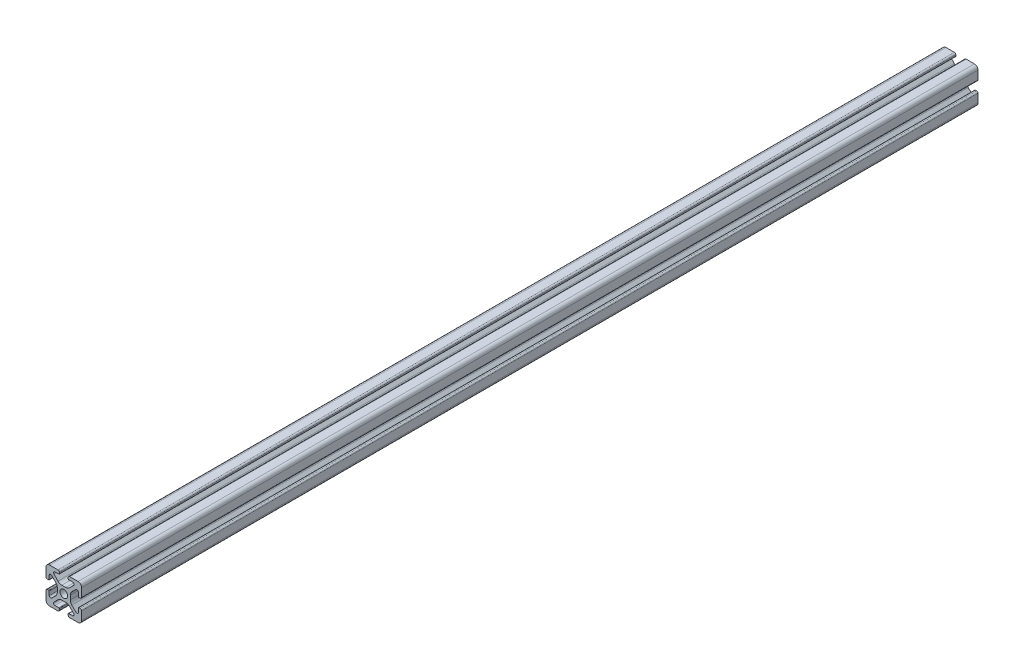
from build123d import *

# Parameters (mm, degrees)
ESQUISSE1_R        = 2.15
BOSS_EXTRU_1_DEPTH = 504


with BuildPart() as part:
    # Esquisse1 → Boss.-Extru.1 (new body)
    with BuildSketch(Plane(origin=(0, 0, 0), x_dir=(-1, 0, 0), z_dir=(0, 0, -1))):
        with BuildLine():
            Line((-20, 6.7), (-20, 2))
            ThreePointArc((-20, 2), (-19.414213562, 0.585786438), (-18, 0))
            Line((-18, 0), (-13.3, 0))
            ThreePointArc((-13.3, 0), (-12.734314575, 0.234314575), (-12.5, 0.8))
            Line((-12.5, 0.8), (-12.5, 1.5))
            ThreePointArc((-12.5, 1.5), (-12.587867966, 1.712132034), (-12.8, 1.8))
            Line((-12.8, 1.8), (-14.918424061, 1.8))
            ThreePointArc((-14.918424061, 1.8), (-15.686700051, 2.313345604), (-15.506437047, 3.219588924))
            Line((-15.506437047, 3.219588924), (-13.254705627, 5.471320344))
            ThreePointArc((-13.254705627, 5.471320344), (-12.281435581, 6.121638598), (-11.133385284, 6.35))
            Line((-11.133385284, 6.35), (-8.866614716, 6.35))
            ThreePointArc((-8.866614716, 6.35), (-7.718564419, 6.121638598), (-6.745294373, 5.471320344))
            Line((-6.745294373, 5.471320344), (-4.493562953, 3.219588924))
            ThreePointArc((-4.493562953, 3.219588924), (-4.313299949, 2.313345604), (-5.081575939, 1.8))
            Line((-5.081575939, 1.8), (-7.2, 1.8))
            ThreePointArc((-7.2, 1.8), (-7.412132034, 1.712132034), (-7.5, 1.5))
            Line((-7.5, 1.5), (-7.5, 0.8))
            ThreePointArc((-7.5, 0.8), (-7.265685425, 0.234314575), (-6.7, 0))
            Line((-6.7, 0), (-2, 0))
            ThreePointArc((-2, 0), (-0.585786438, 0.585786438), (0, 2))
            Line((0, 2), (0, 6.7))
            ThreePointArc((0, 6.7), (-0.234314575, 7.265685425), (-0.8, 7.5))
            Line((-0.8, 7.5), (-1.5, 7.5))
            ThreePointArc((-1.5, 7.5), (-1.712132034, 7.412132034), (-1.8, 7.2))
            Line((-1.8, 7.2), (-1.8, 5.081575939))
            ThreePointArc((-1.8, 5.081575939), (-2.313345604, 4.313299949), (-3.219588924, 4.493562953))
            Line((-3.219588924, 4.493562953), (-5.471320344, 6.745294373))
            ThreePointArc((-5.471320344, 6.745294373), (-6.121638598, 7.718564419), (-6.35, 8.866614716))
            Line((-6.35, 8.866614716), (-6.35, 11.133385284))
            ThreePointArc((-6.35, 11.133385284), (-6.121638598, 12.281435581), (-5.471320344, 13.254705627))
            Line((-5.471320344, 13.254705627), (-3.219588924, 15.506437047))
            ThreePointArc((-3.219588924, 15.506437047), (-2.313345604, 15.686700051), (-1.8, 14.918424061))
            Line((-1.8, 14.918424061), (-1.8, 12.8))
            ThreePointArc((-1.8, 12.8), (-1.712132034, 12.587867966), (-1.5, 12.5))
            Line((-1.5, 12.5), (-0.8, 12.5))
            ThreePointArc((-0.8, 12.5), (-0.234314575, 12.734314575), (0, 13.3))
            Line((0, 13.3), (0, 18))
            ThreePointArc((0, 18), (-0.585786438, 19.414213562), (-2, 20))
            Line((-2, 20), (-6.7, 20))
            ThreePointArc((-6.7, 20), (-7.265685425, 19.765685425), (-7.5, 19.2))
            Line((-7.5, 19.2), (-7.5, 18.5))
            ThreePointArc((-7.5, 18.5), (-7.412132034, 18.287867966), (-7.2, 18.2))
            Line((-7.2, 18.2), (-5.081575939, 18.2))
            ThreePointArc((-5.081575939, 18.2), (-4.313299949, 17.686654396), (-4.493562953, 16.780411076))
            Line((-4.493562953, 16.780411076), (-6.745294373, 14.528679656))
            ThreePointArc((-6.745294373, 14.528679656), (-7.718564419, 13.878361402), (-8.866614716, 13.65))
            Line((-8.866614716, 13.65), (-11.133385284, 13.65))
            ThreePointArc((-11.133385284, 13.65), (-12.281435581, 13.878361402), (-13.254705627, 14.528679656))
            Line((-13.254705627, 14.528679656), (-15.506437047, 16.780411076))
            ThreePointArc((-15.506437047, 16.780411076), (-15.686700051, 17.686654396), (-14.918424061, 18.2))
            Line((-14.918424061, 18.2), (-12.8, 18.2))
            ThreePointArc((-12.8, 18.2), (-12.587867966, 18.287867966), (-12.5, 18.5))
            Line((-12.5, 18.5), (-12.5, 19.2))
            ThreePointArc((-12.5, 19.2), (-12.734314575, 19.765685425), (-13.3, 20))
            Line((-13.3, 20), (-18, 20))
            ThreePointArc((-18, 20), (-19.414213562, 19.414213562), (-20, 18))
            Line((-20, 18), (-20, 13.3))
            ThreePointArc((-20, 13.3), (-19.765685425, 12.734314575), (-19.2, 12.5))
            Line((-19.2, 12.5), (-18.5, 12.5))
            ThreePointArc((-18.5, 12.5), (-18.287867966, 12.587867966), (-18.2, 12.8))
            Line((-18.2, 12.8), (-18.2, 14.918424061))
            ThreePointArc((-18.2, 14.918424061), (-17.686654396, 15.686700051), (-16.780411076, 15.506437047))
            Line((-16.780411076, 15.506437047), (-14.528679656, 13.254705627))
            ThreePointArc((-14.528679656, 13.254705627), (-13.878361402, 12.281435581), (-13.65, 11.133385284))
            Line((-13.65, 11.133385284), (-13.65, 8.866614716))
            ThreePointArc((-13.65, 8.866614716), (-13.878361402, 7.718564419), (-14.528679656, 6.745294373))
            Line((-14.528679656, 6.745294373), (-16.780411076, 4.493562953))
            ThreePointArc((-16.780411076, 4.493562953), (-17.686654396, 4.313299949), (-18.2, 5.081575939))
            Line((-18.2, 5.081575939), (-18.2, 7.2))
            ThreePointArc((-18.2, 7.2), (-18.287867966, 7.412132034), (-18.5, 7.5))
            Line((-18.5, 7.5), (-19.2, 7.5))
            ThreePointArc((-19.2, 7.5), (-19.765685425, 7.265685425), (-20, 6.7))
        make_face()
        with Locations(Location((-10, 10, 0), (0, 0, 180))):
            Circle(ESQUISSE1_R, mode=Mode.SUBTRACT)
    extrude(amount=-BOSS_EXTRU_1_DEPTH)


solid = part.part
